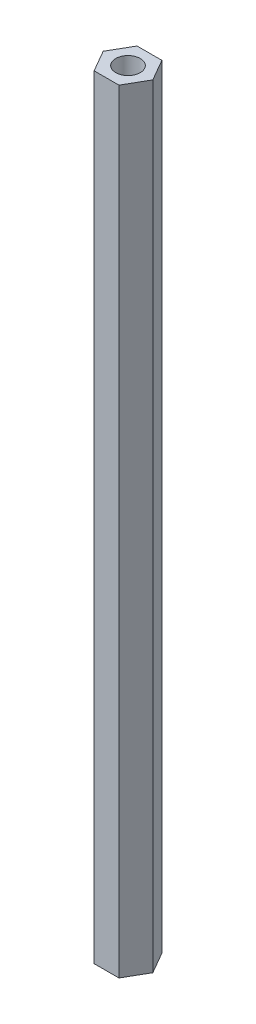
from build123d import *

# Parameters (mm, degrees)
SKETCH1_R           = 2
BOSS_EXTRUDE1_DEPTH = 126


with BuildPart() as part:
    # Sketch1 → Boss-Extrude1 (new body)
    with BuildSketch(Plane(origin=(0, 0, 0), x_dir=(1, 0, 0), z_dir=(0, 1, 0))):
        Polygon((4.041451884, 0), (2.020725942, 3.5), (-2.020725942, 3.5), (-4.041451884, 0), (-2.020725942, -3.5), (2.020725942, -3.5), align=None)
        with Locations(Location((0, 0, 0), (0, 0, 270))):
            Circle(SKETCH1_R, mode=Mode.SUBTRACT)
    extrude(amount=BOSS_EXTRUDE1_DEPTH)


solid = part.part
